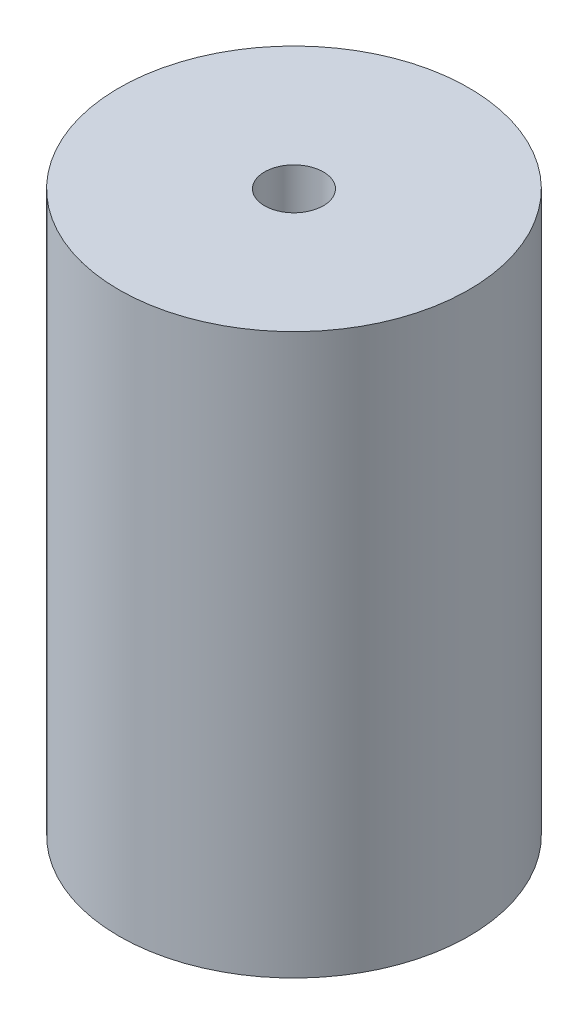
from build123d import *

# Parameters (mm, degrees)
CROQUIS1_R              = 12.5
SALIENTE_EXTRUIR1_DEPTH = 40
SKETCH1_R               = 2.1
CUT_EXTRUDE1_DEPTH      = 21


with BuildPart() as part:
    # Croquis1 → Saliente-Extruir1 (new body)
    with BuildSketch(Plane(origin=(0, 0, 0), x_dir=(1, 0, 0), z_dir=(0, 1, 0))):
        with Locations(Location((0, 0, 0), (0, 0, 270))):
            Circle(CROQUIS1_R)
    extrude(amount=SALIENTE_EXTRUIR1_DEPTH)

    # Sketch1 → Cut-Extrude1 (cut)
    with BuildSketch(Plane(origin=(0, 40, 0), x_dir=(1, 0, 0), z_dir=(0, 1, 0))):
        with Locations(Location((0, 0, 0), (0, 0, 270))):
            Circle(SKETCH1_R)
    extrude(amount=-CUT_EXTRUDE1_DEPTH, mode=Mode.SUBTRACT)


solid = part.part
